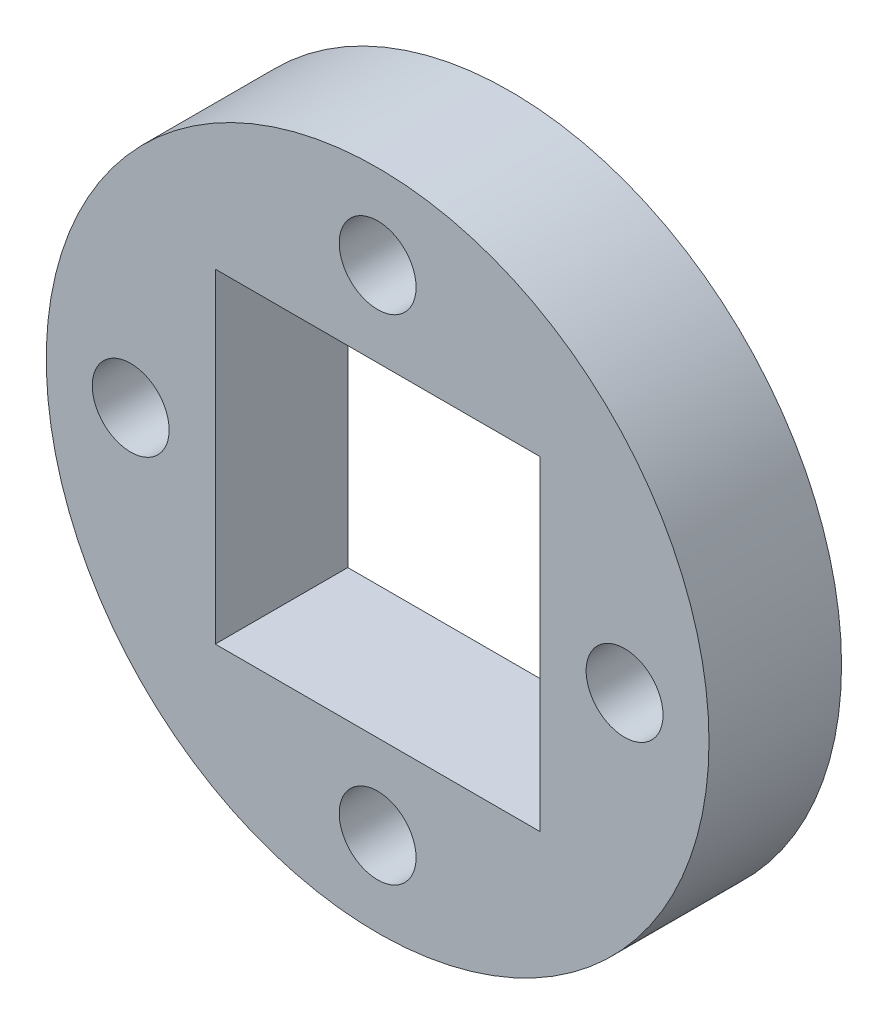
from build123d import *

# Parameters (mm, degrees)
SKETCH1_R           = 12.5
BOSS_EXTRUDE1_DEPTH = 2.5
CUT_EXTRUDE1_REACH  = 20.371
SKETCH8_W           = 12.25
SKETCH8_H           = 12.25
CUT_EXTRUDE4_REACH  = 20.371
SKETCH11_R          = 1.45


with BuildPart() as part:
    # Sketch1 → Boss-Extrude1 (new, symmetric)
    with BuildSketch(Plane.XY):
        Circle(SKETCH1_R)
    extrude(amount=BOSS_EXTRUDE1_DEPTH, both=True)

    # Sketch8 → Cut-Extrude1 (cut, up to next)
    with BuildSketch(Plane.XY.offset(2.5), mode=Mode.PRIVATE) as cut_extrude1_sk1:
        Rectangle(SKETCH8_W, SKETCH8_H)
    cut_extrude1_tool1 = extrude(cut_extrude1_sk1.sketch, amount=-CUT_EXTRUDE1_REACH, mode=Mode.PRIVATE) & part.part
    add(cut_extrude1_tool1.solids().sort_by_distance((0, 0, 2.5))[0], mode=Mode.SUBTRACT)

    # Sketch11 → Cut-Extrude4 (cut, up to next)
    with BuildSketch(Plane.XY.offset(2.5), mode=Mode.PRIVATE) as cut_extrude4_sk1:
        with Locations((9.315, 0)):
            Circle(SKETCH11_R)
    cut_extrude4_tool1 = extrude(cut_extrude4_sk1.sketch, amount=-CUT_EXTRUDE4_REACH, mode=Mode.PRIVATE) & part.part
    # Sketch11 → Cut-Extrude4 (cut, up to next)
    with BuildSketch(Plane.XY.offset(2.5), mode=Mode.PRIVATE) as cut_extrude4_sk2:
        with Locations((0, -9.315)):
            Circle(SKETCH11_R)
    cut_extrude4_tool2 = extrude(cut_extrude4_sk2.sketch, amount=-CUT_EXTRUDE4_REACH, mode=Mode.PRIVATE) & part.part
    # Sketch11 → Cut-Extrude4 (cut, up to next)
    with BuildSketch(Plane.XY.offset(2.5), mode=Mode.PRIVATE) as cut_extrude4_sk3:
        with Locations((-9.315, 0)):
            Circle(SKETCH11_R)
    cut_extrude4_tool3 = extrude(cut_extrude4_sk3.sketch, amount=-CUT_EXTRUDE4_REACH, mode=Mode.PRIVATE) & part.part
    # Sketch11 → Cut-Extrude4 (cut, up to next)
    with BuildSketch(Plane.XY.offset(2.5), mode=Mode.PRIVATE) as cut_extrude4_sk4:
        with Locations((0, 9.315)):
            Circle(SKETCH11_R)
    cut_extrude4_tool4 = extrude(cut_extrude4_sk4.sketch, amount=-CUT_EXTRUDE4_REACH, mode=Mode.PRIVATE) & part.part
    add(cut_extrude4_tool1.solids().sort_by_distance((9.315, 0, 2.5))[0], mode=Mode.SUBTRACT)
    add(cut_extrude4_tool2.solids().sort_by_distance((0, -9.315, 2.5))[0], mode=Mode.SUBTRACT)
    add(cut_extrude4_tool3.solids().sort_by_distance((-9.315, 0, 2.5))[0], mode=Mode.SUBTRACT)
    add(cut_extrude4_tool4.solids().sort_by_distance((0, 9.315, 2.5))[0], mode=Mode.SUBTRACT)


solid = part.part
